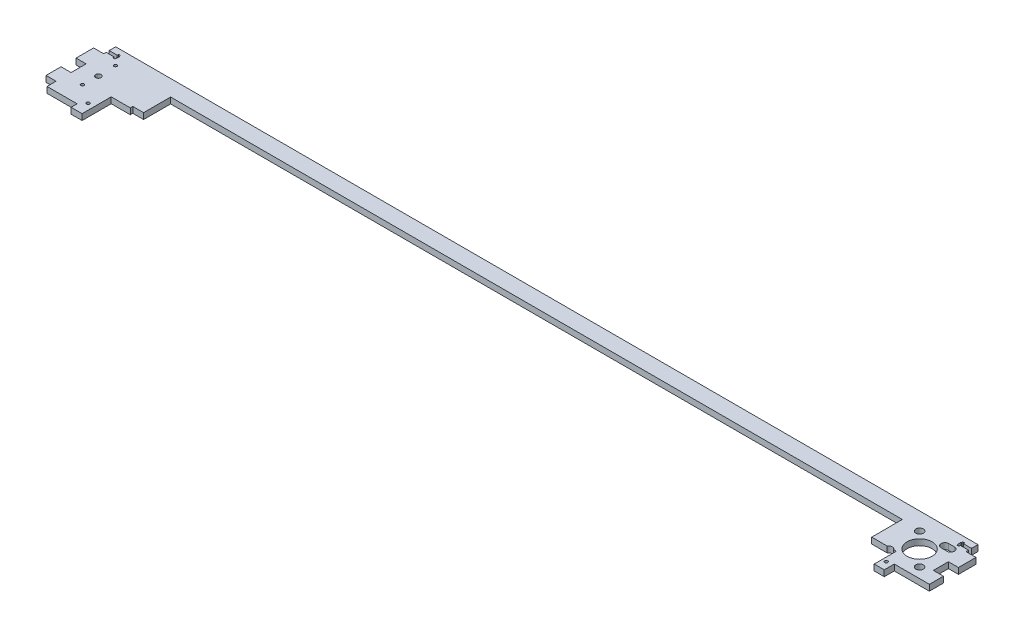
from build123d import *

# Parameters (mm, degrees)
DODANIE_WYCI_GNI_CIE2_DEPTH      = 3
DODANIE_WYCI_GNI_CIE2_DEPTH_BACK = 3
SZKIC1_W                         = 880
SZKIC1_H                         = 74.5
SZKIC1_W_2                       = 736
SZKIC1_H_2                       = 28
SZKIC2_W                         = 40
SZKIC2_H                         = 6
WYTNIJ_WYCI_GNI_CIE1_DEPTH       = 6
SZYK_LINIOWY1_COUNT              = 13
SZYK_LINIOWY1_PITCH              = 91
WYTNIJ_WYCI_GNI_CIE2_DEPTH       = 6
SZKIC4_W                         = 10
SZKIC4_H                         = 15
SZKIC4_H_2                       = 9
SZKIC4_H_3                       = 12
WYTNIJ_WYCI_GNI_CIE3_DEPTH       = 6
WYTNIJ_WYCI_GNI_CIE4_DEPTH       = 6
SZKIC8_R                         = 1.55
SZKIC8_R_2                       = 2.7
WYTNIJ_WYCI_GNI_CIE5_DEPTH       = 6
SZKIC9_R                         = 12.5
WYTNIJ_WYCI_GNI_CIE6_DEPTH       = 6
SZKIC13_W                        = 30
SZKIC13_H                        = 16
WYTNIJ_WYCI_GNI_CIE8_DEPTH       = 6
SZYK_LINIOWY3_COUNT              = 2
SZYK_LINIOWY3_PITCH              = 91
SZYK_LINIOWY3_COUNT_DIR2         = 3
SZYK_LINIOWY3_PITCH_DIR2         = 273
SZKIC15_W                        = 765.002168891
SZKIC15_H                        = 31.530782264
WYTNIJ_WYCI_GNI_CIE9_DEPTH       = 10
SZKIC16_R                        = 1.55
WYTNIJ_WYCI_GNI_CIE10_DEPTH      = 10
SZKIC17_W                        = 24
SZKIC17_H                        = 29.031184719
WYTNIJ_WYCI_GNI_CIE11_DEPTH      = 6
SZKIC20_W                        = 5
SZKIC20_H                        = 10
DODANIE_WYCI_GNI_CIE3_DEPTH      = 6
SZKIC18_W                        = 24.502253475
SZKIC18_H                        = 3.530782264
DODANIE_WYCI_GNI_CIE4_DEPTH      = 6
SZKIC21_W                        = 6.3
SZKIC21_H                        = 26.969217736
DODANIE_WYCI_GNI_CIE5_DEPTH      = 6
SZKIC22_W                        = 10
SZKIC22_H                        = 10
WYTNIJ_WYCI_GNI_CIE12_DEPTH      = 10
SZKIC11_R                        = 3.75
WYTNIJ_WYCI_GNI_CIE7_DEPTH       = 6


with BuildPart() as part:
    # Szkic1 → Dodanie-wyciągnięcie2 (new, two sides: drawn at the far end of the back side and taken through both)
    with BuildSketch(Plane(origin=(0, -418.87633849, -418.87633849), x_dir=(1, 0, 0), z_dir=(0, 1, 0)).offset(-DODANIE_WYCI_GNI_CIE2_DEPTH_BACK)):
        with Locations((-705.368459045, -446.12633849)):
            Rectangle(SZKIC1_W, SZKIC1_H)
        with Locations((-702.868459045, -438.87633849)):
            Rectangle(SZKIC1_W_2, SZKIC1_H_2, mode=Mode.SUBTRACT)
    extrude(amount=DODANIE_WYCI_GNI_CIE2_DEPTH + DODANIE_WYCI_GNI_CIE2_DEPTH_BACK)

    # Szkic2 → Wytnij-wyciągnięcie1 (cut)
    with BuildSketch(Plane.XY.offset(64.5)):
        with Locations((-1125.368459045, -418.87633849)):
            Rectangle(SZKIC2_W, SZKIC2_H)
    wytnij_wyci_gni_cie1 = extrude(amount=-WYTNIJ_WYCI_GNI_CIE1_DEPTH, mode=Mode.SUBTRACT)

    # Szyk liniowy1: Wytnij-wyciągnięcie1 ×13
    with Locations(*[(i * SZYK_LINIOWY1_PITCH, 0, 0) for i in range(1, SZYK_LINIOWY1_COUNT)]):
        add(wytnij_wyci_gni_cie1, mode=Mode.SUBTRACT)

    # Szkic3 → Wytnij-wyciągnięcie2 (cut)
    with BuildSketch(Plane(origin=(0, -415.87633849, 0), x_dir=(1, 0, 0), z_dir=(0, 1, 0))):
        Polygon((-1032.818459045, -58.5), (-1035.918459045, -58.5), (-1035.918459045, -54.5), (-1037.293459045, -54.5), (-1037.293459045, -52.5), (-1035.918459045, -52.5), (-1035.918459045, -52), (-1032.818459045, -52), (-1032.818459045, -52.5), (-1031.443459045, -52.5), (-1031.443459045, -54.5), (-1032.818459045, -54.5), align=None)
    wytnij_wyci_gni_cie2 = extrude(amount=-WYTNIJ_WYCI_GNI_CIE2_DEPTH, mode=Mode.SUBTRACT)

    # Szkic4 → Wytnij-wyciągnięcie3 (cut)
    with BuildSketch(Plane(origin=(0, -415.87633849, 0), x_dir=(1, 0, 0), z_dir=(0, 1, 0))):
        with Locations((-1140.368459045, -27)):
            Rectangle(SZKIC4_W, SZKIC4_H)
        with Locations((-1140.368459045, -54)):
            Rectangle(SZKIC4_W, SZKIC4_H_2)
        with Locations((-1140.368459045, 4)):
            Rectangle(SZKIC4_W, SZKIC4_H_3)
    wytnij_wyci_gni_cie3 = extrude(amount=-WYTNIJ_WYCI_GNI_CIE3_DEPTH, mode=Mode.SUBTRACT)

    # Szkic5 → Wytnij-wyciągnięcie4 (cut)
    with BuildSketch(Plane(origin=(0, -415.87633849, 0), x_dir=(1, 0, 0), z_dir=(0, 1, 0))):
        Polygon((-1135.368459045, 3.55), (-1127.368459045, 3.55), (-1127.368459045, 4.925), (-1125.368459045, 4.925), (-1125.368459045, 3.55), (-1124.868459045, 3.55), (-1124.868459045, 0.45), (-1125.368459045, 0.45), (-1125.368459045, -0.925), (-1127.368459045, -0.925), (-1127.368459045, 0.45), (-1135.368459045, 0.45), align=None)
    wytnij_wyci_gni_cie4 = extrude(amount=-WYTNIJ_WYCI_GNI_CIE4_DEPTH, mode=Mode.SUBTRACT)

    # Lustro1: Wytnij-wyciągnięcie3, Wytnij-wyciągnięcie4 across plane
    add(wytnij_wyci_gni_cie3.mirror(Plane.ZY.offset(705.368459045)), mode=Mode.SUBTRACT)
    add(wytnij_wyci_gni_cie4.mirror(Plane.ZY.offset(705.368459045)), mode=Mode.SUBTRACT)

    # Szkic8 → Wytnij-wyciągnięcie5 (cut)
    with BuildSketch(Plane.XZ.offset(421.87633849)):
        with Locations((-1119.26479978, 39.289778966)):
            Circle(SZKIC8_R)
        with Locations((-1119.26479978, 6.289778966)):
            Circle(SZKIC8_R)
        with Locations((-1118.705640448, 24)):
            Circle(SZKIC8_R_2)
    extrude(amount=-WYTNIJ_WYCI_GNI_CIE5_DEPTH, mode=Mode.SUBTRACT)

    # Szkic9 → Wytnij-wyciągnięcie6 (cut)
    with BuildSketch(Plane(origin=(0, -415.87633849, 0), x_dir=(1, 0, 0), z_dir=(0, 1, 0))):
        with Locations((-300.706340265, -22.93)):
            Circle(SZKIC9_R)
    extrude(amount=-WYTNIJ_WYCI_GNI_CIE6_DEPTH, mode=Mode.SUBTRACT)

    # Szkic13 → Wytnij-wyciągnięcie8 (cut)
    with BuildSketch(Plane(origin=(0, -415.87633849, 0), x_dir=(1, 0, 0), z_dir=(0, 1, 0))):
        with Locations((-280.368459045, -56.5)):
            Rectangle(SZKIC13_W, SZKIC13_H)
    extrude(amount=-WYTNIJ_WYCI_GNI_CIE8_DEPTH, mode=Mode.SUBTRACT)

    # Szyk liniowy3: Wytnij-wyci_gni_cie2 2 × 3
    with Locations(*[Vector(1, 0, 0) * (i * SZYK_LINIOWY3_PITCH) + Vector(1, 0, 0) * (j * SZYK_LINIOWY3_PITCH_DIR2) for i in range(SZYK_LINIOWY3_COUNT) for j in range(SZYK_LINIOWY3_COUNT_DIR2) if (i, j) != (0, 0)]):
        add(wytnij_wyci_gni_cie2, mode=Mode.SUBTRACT)

    # Szkic15 → Wytnij-wyciągnięcie9 (cut)
    with BuildSketch(Plane(origin=(0, -415.87633849, 0), x_dir=(1, 0, 0), z_dir=(0, 1, 0))):
        with Locations((-692.867290015, -48.734608868)):
            Rectangle(SZKIC15_W, SZKIC15_H)
    extrude(amount=-WYTNIJ_WYCI_GNI_CIE9_DEPTH, mode=Mode.SUBTRACT)

    # Szkic16 → Wytnij-wyciągnięcie10 (cut)
    with BuildSketch(Plane(origin=(0, -415.87633849, 0), x_dir=(1, 0, 0), z_dir=(0, 1, 0))):
        with Locations((-306.36620557, -50.5)):
            Circle(SZKIC16_R)
        with Locations((-1100.368459045, -52.5)):
            Circle(SZKIC16_R)
    extrude(amount=-WYTNIJ_WYCI_GNI_CIE10_DEPTH, mode=Mode.SUBTRACT)

    # Szkic17 → Wytnij-wyciągnięcie11 (cut)
    with BuildSketch(Plane(origin=(0, -415.87633849, 0), x_dir=(1, 0, 0), z_dir=(0, 1, 0))):
        with Locations((-1082.368459045, -49.984407641)):
            Rectangle(SZKIC17_W, SZKIC17_H)
    extrude(amount=-WYTNIJ_WYCI_GNI_CIE11_DEPTH, mode=Mode.SUBTRACT)

    # Szkic20 → Dodanie-wyciągnięcie3 (add)
    with BuildSketch(Plane.XZ.offset(421.87633849)):
        with Locations((-292.868459045, 53.5)):
            Rectangle(SZKIC20_W, SZKIC20_H)
    extrude(amount=-DODANIE_WYCI_GNI_CIE3_DEPTH)

    # Szkic18 → Dodanie-wyciągnięcie4 (add)
    with BuildSketch(Plane.XZ.offset(421.87633849)):
        with Locations((-322.617332308, 34.734608868)):
            Rectangle(SZKIC18_W, SZKIC18_H)
    extrude(amount=-DODANIE_WYCI_GNI_CIE4_DEPTH)

    # Szkic21 → Dodanie-wyciągnięcie5 (add)
    with BuildSketch(Plane(origin=(0, -415.87633849, 0), x_dir=(1, 0, 0), z_dir=(0, 1, 0))):
        with Locations((-1067.718459045, -19.484608868)):
            Rectangle(SZKIC21_W, SZKIC21_H)
    extrude(amount=-DODANIE_WYCI_GNI_CIE5_DEPTH)

    # Szkic22 → Wytnij-wyciągnięcie12 (cut)
    with BuildSketch(Plane(origin=(0, -415.87633849, 0), x_dir=(1, 0, 0), z_dir=(0, 1, 0))):
        with Locations((-295.368459045, -53.5)):
            Rectangle(SZKIC22_W, SZKIC22_H)
    extrude(amount=-WYTNIJ_WYCI_GNI_CIE12_DEPTH, mode=Mode.SUBTRACT)

    # Szkic11 → Wytnij-wyciągnięcie7 (cut)
    with BuildSketch(Plane.XZ.offset(421.87633849)):
        with Locations((-285.206340265, 38.43)):
            Circle(SZKIC11_R)
        with Locations((-316.206340265, 38.43)):
            Circle(SZKIC11_R)
        with Locations((-316.206340265, 7.43)):
            Circle(SZKIC11_R)
        with BuildLine():
            Line((-285.206340265, 3.68), (-290.934328079, 3.68))
            ThreePointArc((-290.934328079, 3.68), (-294.684328079, 7.43), (-290.934328079, 11.18))
            Line((-290.934328079, 11.18), (-285.206340265, 11.18))
            ThreePointArc((-285.206340265, 11.18), (-281.456340265, 7.43), (-285.206340265, 3.68))
        make_face()
    extrude(amount=-WYTNIJ_WYCI_GNI_CIE7_DEPTH, mode=Mode.SUBTRACT)


solid = part.part
